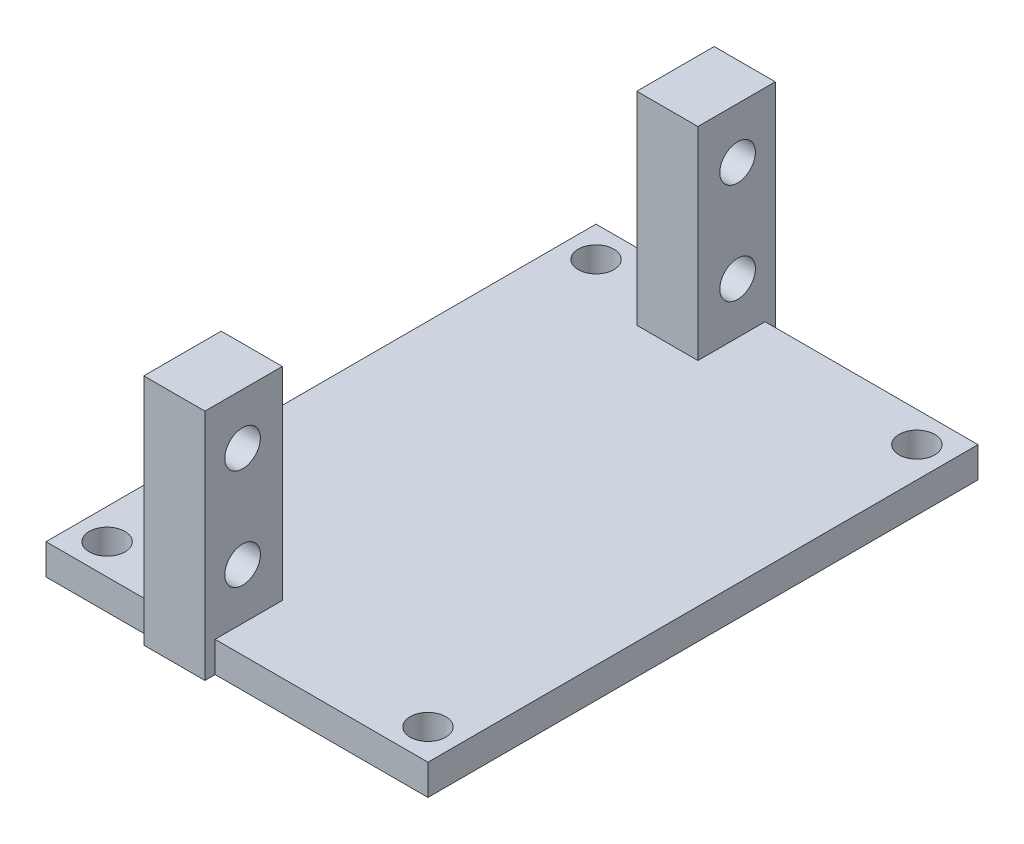
from build123d import *

# Parameters (mm, degrees)
SKETCH_1_W           = 37.5
SKETCH_1_H           = 54
EXTRUDE_1_DEPTH      = 3
EXTRUDE_2_DEPTH      = 19.9
EXTRUDE_2_DEPTH_BACK = 3
SKETCH_2_W           = 6
SKETCH_2_H           = 7.6
SKETCH_3_R           = 1.75
CUT_EXTRUDE_1_DEPTH  = 42.775830333
SKETCH_4_R           = 1.75
CUT_EXTRUDE_2_DEPTH  = 40.135310143


with BuildPart() as part:
    # 草图1 → 凸台-拉伸1 (new body)
    with BuildSketch(Plane(origin=(0, 0, 0), x_dir=(1, 0, 0), z_dir=(0, 1, 0))):
        Rectangle(SKETCH_1_W, SKETCH_1_H)
    extrude(amount=EXTRUDE_1_DEPTH)

    # 草图2 → 凸台-拉伸2 (add, two sides: drawn at the far end of the back side and taken through both)
    with BuildSketch(Plane(origin=(0, 3, 0), x_dir=(1, 0, 0), z_dir=(0, 1, 0)).offset(-EXTRUDE_2_DEPTH_BACK)):
        with Locations((-5.15, -24.2)):
            Rectangle(SKETCH_2_W, SKETCH_2_H)
        with Locations((-5.15, 24.2)):
            Rectangle(SKETCH_2_W, SKETCH_2_H)
    extrude(amount=EXTRUDE_2_DEPTH + EXTRUDE_2_DEPTH_BACK)

    # 草图3 → 切除-拉伸1 (cut, through all)
    with BuildSketch(Plane(origin=(-2.15, 0, 0), x_dir=(0, 0, -1), z_dir=(1, 0, 0))):
        with Locations((-24.3, 17.9)):
            Circle(SKETCH_3_R)
        with Locations((-24.3, 8)):
            Circle(SKETCH_3_R)
        with Locations((24.3, 8)):
            Circle(SKETCH_3_R)
        with Locations((24.3, 17.9)):
            Circle(SKETCH_3_R)
    extrude(amount=-CUT_EXTRUDE_1_DEPTH, mode=Mode.SUBTRACT)

    # 草图4 → 切除-拉伸2 (cut, through all)
    with BuildSketch(Plane(origin=(0, 3, 0), x_dir=(1, 0, 0), z_dir=(0, 1, 0))):
        with Locations(Location((-15.75, 24, 0), (0, 0, 270))):
            Circle(SKETCH_4_R)
        with Locations(Location((-15.75, -24, 0), (0, 0, 270))):
            Circle(SKETCH_4_R)
        with Locations(Location((15.75, -24, 0), (0, 0, 270))):
            Circle(SKETCH_4_R)
        with Locations(Location((15.75, 24, 0), (0, 0, 270))):
            Circle(SKETCH_4_R)
    extrude(amount=-CUT_EXTRUDE_2_DEPTH, mode=Mode.SUBTRACT)


solid = part.part
